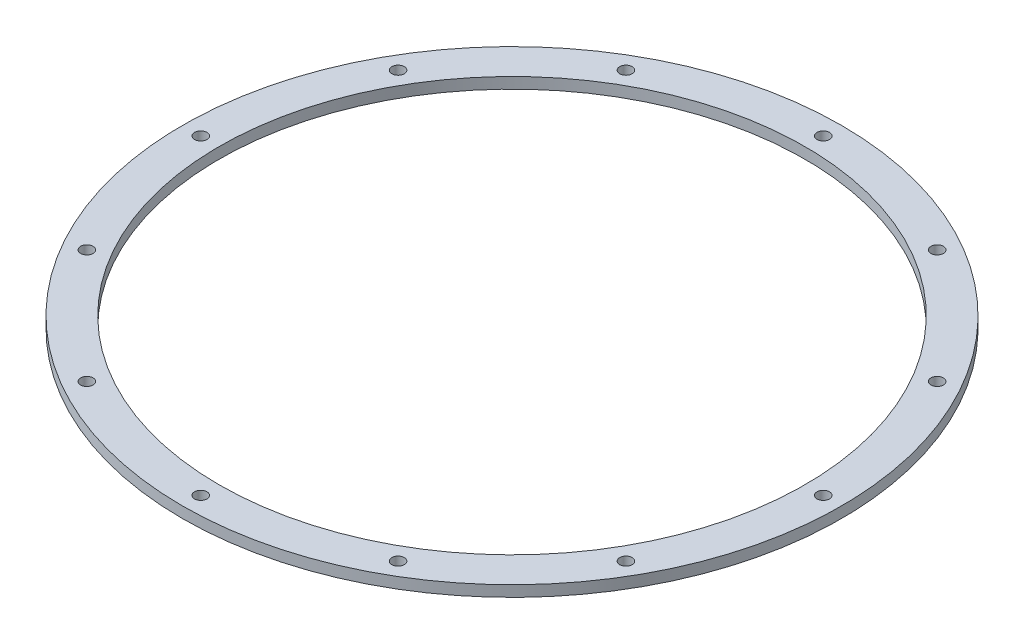
from build123d import *

# Parameters (mm, degrees)
SKETCH1_R           = 90
SKETCH1_R_2         = 80
SKETCH1_R_3         = 1.7
BOSS_EXTRUDE1_DEPTH = 3


with BuildPart() as part:
    # Sketch1 → Boss-Extrude1 (new body)
    with BuildSketch(Plane(origin=(0, 0, 0), x_dir=(1, 0, 0), z_dir=(0, 1, 0))):
        with Locations(Location((0, 0, 0), (0, 0, 270))):
            Circle(SKETCH1_R)
        with Locations(Location((0, 0, 0), (0, 0, 270))):
            Circle(SKETCH1_R_2, mode=Mode.SUBTRACT)
        with Locations(Location((0, 85, 0), (0, 0, 270))):
            Circle(SKETCH1_R_3, mode=Mode.SUBTRACT)
        with Locations(Location((42.5, 73.612159322, 0), (0, 0, 270))):
            Circle(SKETCH1_R_3, mode=Mode.SUBTRACT)
        with Locations(Location((73.612159322, 42.5, 0), (0, 0, 270))):
            Circle(SKETCH1_R_3, mode=Mode.SUBTRACT)
        with Locations(Location((85, 0, 0), (0, 0, 270))):
            Circle(SKETCH1_R_3, mode=Mode.SUBTRACT)
        with Locations(Location((73.612159322, -42.5, 0), (0, 0, 270))):
            Circle(SKETCH1_R_3, mode=Mode.SUBTRACT)
        with Locations(Location((42.5, -73.612159322, 0), (0, 0, 270))):
            Circle(SKETCH1_R_3, mode=Mode.SUBTRACT)
        with Locations(Location((0, -85, 0), (0, 0, 270))):
            Circle(SKETCH1_R_3, mode=Mode.SUBTRACT)
        with Locations(Location((-42.5, -73.612159322, 0), (0, 0, 270))):
            Circle(SKETCH1_R_3, mode=Mode.SUBTRACT)
        with Locations(Location((-73.612159322, -42.5, 0), (0, 0, 270))):
            Circle(SKETCH1_R_3, mode=Mode.SUBTRACT)
        with Locations(Location((-85, 0, 0), (0, 0, 270))):
            Circle(SKETCH1_R_3, mode=Mode.SUBTRACT)
        with Locations(Location((-73.612159322, 42.5, 0), (0, 0, 270))):
            Circle(SKETCH1_R_3, mode=Mode.SUBTRACT)
        with Locations(Location((-42.5, 73.612159322, 0), (0, 0, 270))):
            Circle(SKETCH1_R_3, mode=Mode.SUBTRACT)
    extrude(amount=BOSS_EXTRUDE1_DEPTH)


solid = part.part
